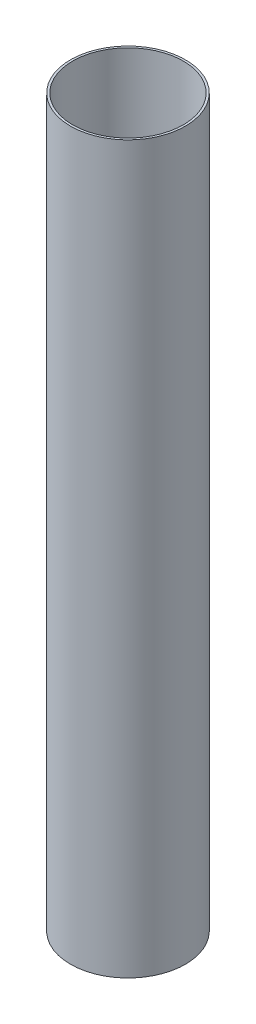
from build123d import *

# Parameters (mm, degrees)
SKETCH1_R               = 39.6
SKETCH1_R_2             = 38.1
BOSS_EXTRUDE1_DEPTH     = 500
CUT_EXTRUDE1_REACH      = 505.127
CUT_EXTRUDE1_END_RADIUS = 39.6
SKETCH2_R               = 2


with BuildPart() as part:
    # Sketch1 → Boss-Extrude1 (new body)
    with BuildSketch(Plane(origin=(0, 0, 0), x_dir=(1, 0, 0), z_dir=(0, 1, 0))):
        with Locations(Location((0, 0, 0), (0, 0, 270))):
            Circle(SKETCH1_R)
        with Locations(Location((0, 0, 0), (0, 0, 270))):
            Circle(SKETCH1_R_2, mode=Mode.SUBTRACT)
    extrude(amount=BOSS_EXTRUDE1_DEPTH)

    # Cut-Extrude1: up to this cylinder (the profile starts inside it)
    cut_extrude1_end = Plane(origin=(0, 310, 0), z_dir=(0, -1, 0)) * Cylinder(CUT_EXTRUDE1_END_RADIUS, 1090.454, mode=Mode.PRIVATE)
    # Sketch2 → Cut-Extrude1 (cut, up to the surface)
    with BuildSketch(Plane(origin=(0, 0, 0), x_dir=(0, 0, -1), z_dir=(1, 0, 0)), mode=Mode.PRIVATE) as cut_extrude1_sk1:
        with Locations((0, 310)):
            Circle(SKETCH2_R)
    cut_extrude1_tool1 = extrude(cut_extrude1_sk1.sketch, amount=-CUT_EXTRUDE1_REACH, mode=Mode.PRIVATE) & cut_extrude1_end
    add(cut_extrude1_tool1.solids().sort_by_distance((0, 310, 0))[0], mode=Mode.SUBTRACT)


solid = part.part
